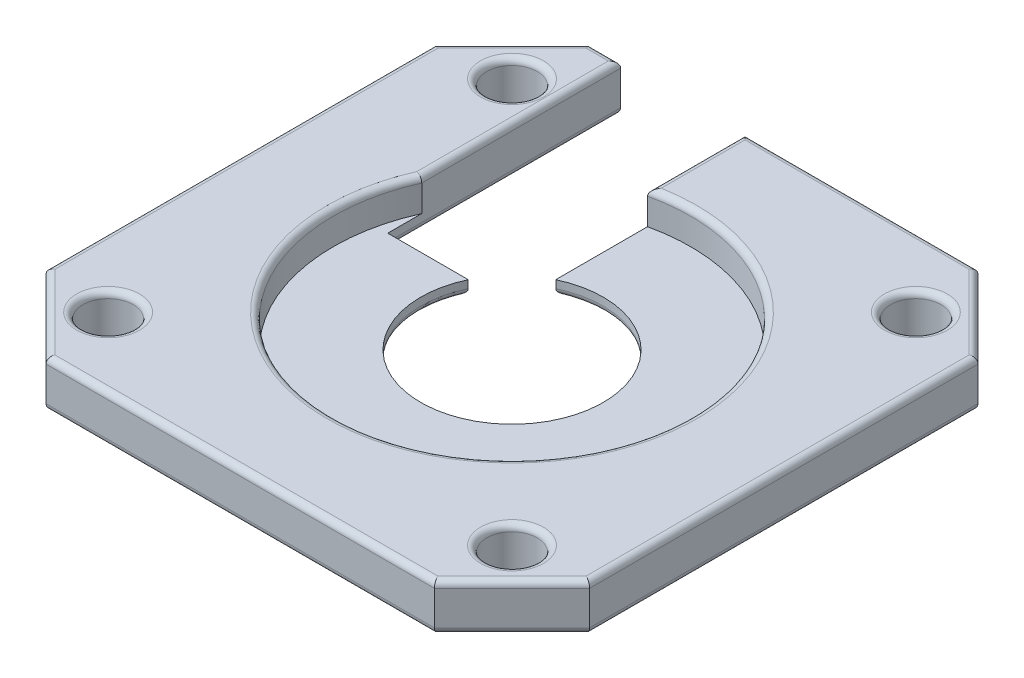
from build123d import *

# Parameters (mm, degrees)
SKETCH1_R           = 1.625
BOSS_EXTRUDE1_DEPTH = 3
SKETCH2_R           = 11.5
CUT_EXTRUDE1_DEPTH  = 2.1
SKETCH3_R           = 5.875
CUT_EXTRUDE2_DEPTH  = 50.588305073
CHAMFER1_SIZE       = 5
FILLET1_R           = 0.4


with BuildPart() as part:
    # Sketch1 → Boss-Extrude1 (new body)
    with BuildSketch(Plane(origin=(0, 0, 0), x_dir=(1, 0, 0), z_dir=(0, 1, 0))):
        Polygon((0, 0), (-35, 0), (-35, 35), (-28, 35), (-28, 20), (-20, 20), (-20, 35), (0, 35), align=None)
        with Locations(Location((-30.5, 30.5, 0), (0, 0, 270))):
            Circle(SKETCH1_R, mode=Mode.SUBTRACT)
        with Locations(Location((-4.5, 30.5, 0), (0, 0, 270))):
            Circle(SKETCH1_R, mode=Mode.SUBTRACT)
        with Locations(Location((-4.5, 4.5, 0), (0, 0, 270))):
            Circle(SKETCH1_R, mode=Mode.SUBTRACT)
        with Locations(Location((-30.5, 4.5, 0), (0, 0, 270))):
            Circle(SKETCH1_R, mode=Mode.SUBTRACT)
    extrude(amount=BOSS_EXTRUDE1_DEPTH)

    # Sketch2 → Cut-Extrude1 (cut)
    with BuildSketch(Plane(origin=(0, 3, 0), x_dir=(1, 0, 0), z_dir=(0, 1, 0))):
        with Locations((-17.5, 17.5)):
            Circle(SKETCH2_R)
    extrude(amount=-CUT_EXTRUDE1_DEPTH, mode=Mode.SUBTRACT)

    # Sketch3 → Cut-Extrude2 (cut, through all)
    with BuildSketch(Plane.XZ):
        with Locations((-17.5, -17.5)):
            Circle(SKETCH3_R)
    extrude(amount=-CUT_EXTRUDE2_DEPTH, mode=Mode.SUBTRACT)

    # Chamfer1
    chamfer1_edges = [part.edges().sort_by_distance(p)[0] for p in [
        (0, 1.5, 0),
        (-35, 1.5, 0),
        (-35, 1.5, -35),
        (0, 1.5, -35),
    ]]
    chamfer(chamfer1_edges, length=CHAMFER1_SIZE)

    # Fillet1
    fillet1_edges = [part.edges().sort_by_distance(p)[0] for p in [
        (-20, 0, -28.90827129),
        (-20, 3, -31.86248608),
        (-30.5, 0, -32.125),
        (-30.5, 3, -32.125),
        (-29, 3, -35),
        (-4.5, 0, -32.125),
        (-4.5, 3, -32.125),
        (-4.5, 0, -6.125),
        (-4.5, 3, -6.125),
        (-30.5, 0, -6.125),
        (-30.5, 3, -6.125),
        (-28, 3, -28.59520788),
        (-10.225035613, 3, -8.593547667),
        (-25.40827129, 0, -20),
        (-13.345747661, 0, -13.345747661),
        (-35, 0, -17.5),
        (-35, 3, -17.5),
        (-12.5, 0, -35),
        (0, 0, -17.5),
        (-17.5, 0, 0),
        (-2.5, 0, -32.5),
        (-32.5, 0, -2.5),
        (-2.5, 0, -2.5),
        (-32.5, 0, -32.5),
        (-17.5, 3, 0),
        (0, 3, -17.5),
        (-12.5, 3, -35),
        (-2.5, 3, -32.5),
        (-32.5, 3, -2.5),
        (-2.5, 3, -2.5),
        (-32.5, 3, -32.5),
        (-29, 0, -35),
        (-28, 0, -27.5),
    ]]
    fillet(fillet1_edges, radius=FILLET1_R)


solid = part.part
